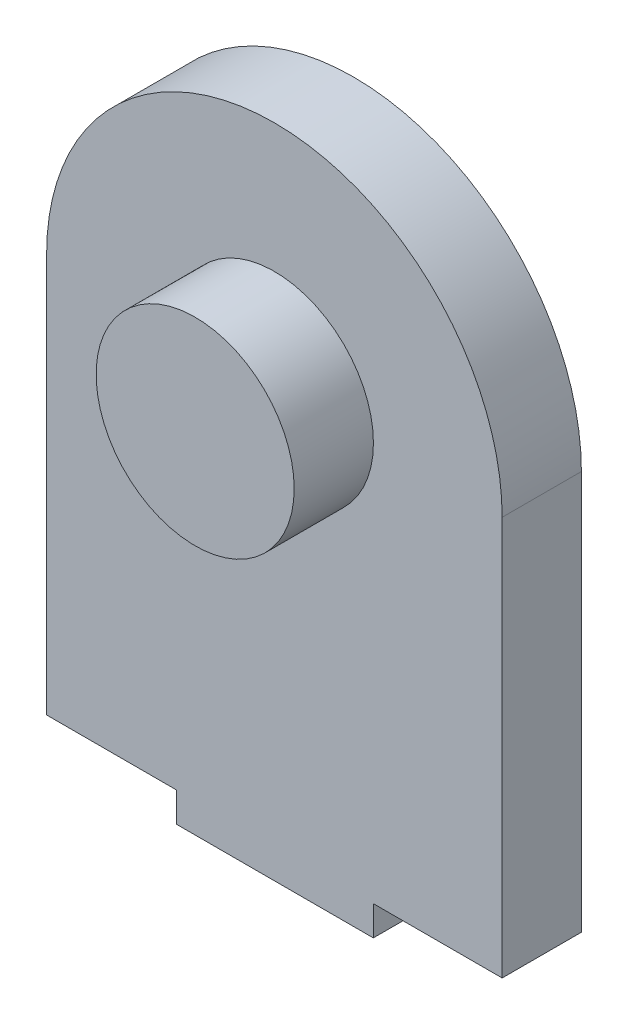
from build123d import *

# Parameters (mm, degrees)
EXTRUDE_1_DEPTH     = 8
SKETCH_2_R          = 10
EXTRUDE_2_DEPTH     = 8
SKETCH_3_W          = 19.850439241
SKETCH_3_H          = 8
EXTRUDE_3_DEPTH     = 3
SKETCH_4_R          = 1.8
CUT_EXTRUDE_1_DEPTH = 5


with BuildPart() as part:
    # 草图1 → 凸台-拉伸1 (new body)
    with BuildSketch(Plane.XY):
        with BuildLine():
            Line((-23, 0), (-23, -40.29))
            Line((-23, -40.29), (23, -40.29))
            Line((23, -40.29), (23, 0))
            ThreePointArc((23, 0), (0, 23), (-23, 0))
        make_face()
    extrude(amount=EXTRUDE_1_DEPTH)

    # 草图2 → 凸台-拉伸2 (add)
    with BuildSketch(Plane.XY.offset(8)):
        Circle(SKETCH_2_R)
    extrude(amount=EXTRUDE_2_DEPTH)

    # 草图3 → 凸台-拉伸3 (add)
    with BuildSketch(Plane(origin=(0, -40.29, 0), x_dir=(-1, 0, 0), z_dir=(0, -1, 0))):
        with Locations((-0.065968244, -4)):
            Rectangle(SKETCH_3_W, SKETCH_3_H)
    extrude(amount=EXTRUDE_3_DEPTH)

    # 草图4 → 切除-拉伸1 (cut)
    with BuildSketch(Plane(origin=(0, -40.29, 0), x_dir=(-1, 0, 0), z_dir=(0, -1, 0))):
        with Locations((19, -4)):
            Circle(SKETCH_4_R)
    cut_extrude_1 = extrude(amount=-CUT_EXTRUDE_1_DEPTH, mode=Mode.SUBTRACT)

    # 镜向1: 切除-拉伸1 across plane
    add(cut_extrude_1.mirror(Plane.ZY), mode=Mode.SUBTRACT)


solid = part.part
